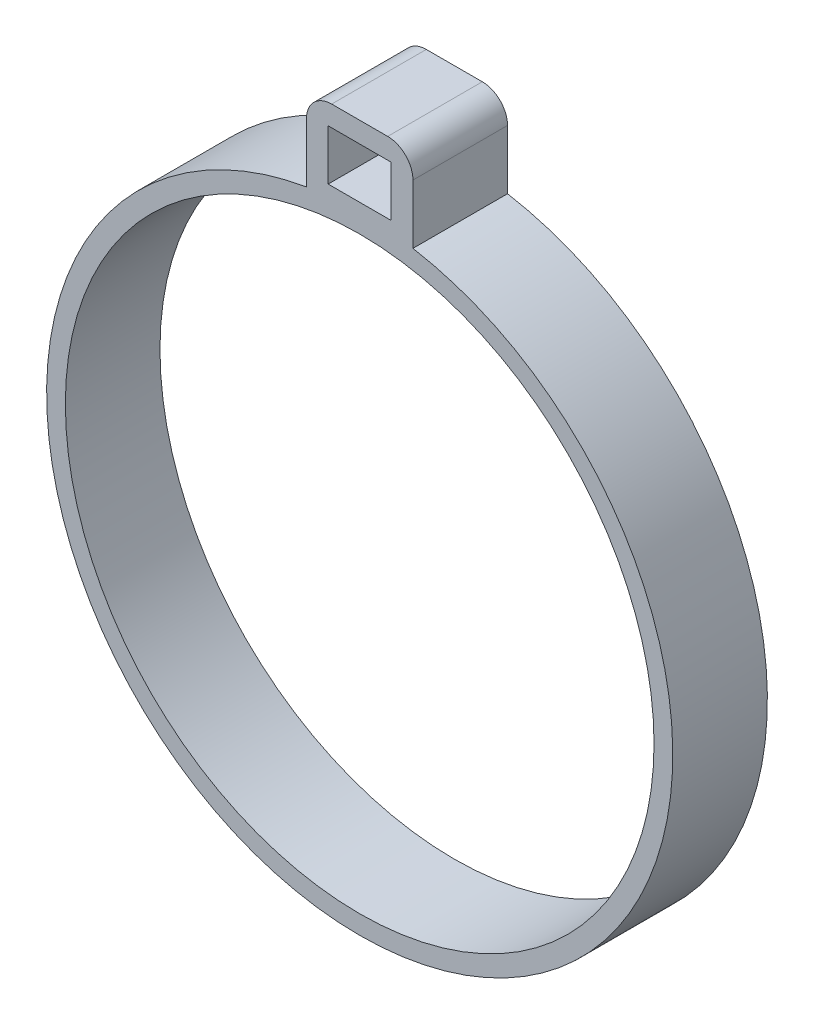
from build123d import *

# Parameters (mm, degrees)
SKETCH1_R           = 49.638488844
SKETCH1_R_2         = 46.667664218
BOSS_EXTRUDE1_DEPTH = 7.5
SKETCH2_W           = 16.879419562
SKETCH2_H           = 14.533093082
SKETCH2_W_2         = 10
SKETCH2_H_2         = 8
BOSS_EXTRUDE2_DEPTH = 15
FILLET1_R           = 4


with BuildPart() as part:
    # Sketch1 → Boss-Extrude1 (new, symmetric)
    with BuildSketch(Plane.XY):
        Circle(SKETCH1_R)
        Circle(SKETCH1_R_2, mode=Mode.SUBTRACT)
    extrude(amount=BOSS_EXTRUDE1_DEPTH, both=True)

    # Sketch2 → Boss-Extrude2 (add)
    with BuildSketch(Plane(origin=(0, 0, -7.5), x_dir=(-1, 0, 0), z_dir=(0, 0, -1))):
        with Locations((0, 55.024649482)):
            Rectangle(SKETCH2_W, SKETCH2_H)
        with Locations((0, 55.024649482)):
            Rectangle(SKETCH2_W_2, SKETCH2_H_2, mode=Mode.SUBTRACT)
    extrude(amount=-BOSS_EXTRUDE2_DEPTH)

    # Fillet1
    fillet1_edges = [part.edges().sort_by_distance(p)[0] for p in [
        (-8.439709781, 62.291196023, 0),
        (8.439709781, 62.291196023, 0),
    ]]
    fillet(fillet1_edges, radius=FILLET1_R)


solid = part.part
